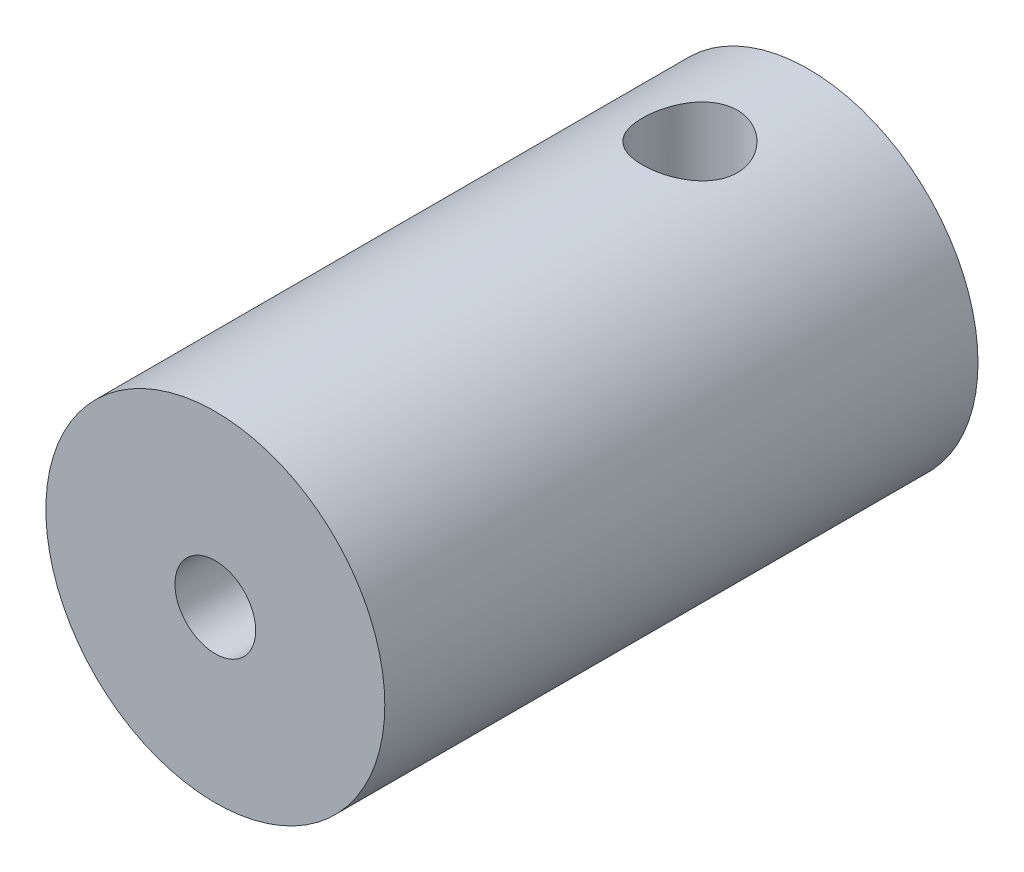
from build123d import *

# Parameters (mm, degrees)
SKETCH1_R           = 10
BOSS_EXTRUDE1_DEPTH = 35
SKETCH2_R           = 2.9
CUT_EXTRUDE1_DEPTH  = 12
CUT_EXTRUDE1_DRAFT  = 1
SKETCH4_R           = 2.38125
CUT_EXTRUDE2_DEPTH  = 35
SKETCH5_R           = 2.8
CUT_EXTRUDE3_DEPTH  = 38.749172176


with BuildPart() as part:
    # Sketch1 → Boss-Extrude1 (new body)
    with BuildSketch(Plane.XY):
        Circle(SKETCH1_R)
    extrude(amount=BOSS_EXTRUDE1_DEPTH)


with BuildPart() as cut_extrude1_tool:
    # Sketch2 → Cut-Extrude1 (with draft: the straight prism first)
    with BuildSketch(Plane.XY.offset(12)):
        Circle(SKETCH2_R)
    extrude(amount=-CUT_EXTRUDE1_DEPTH)
    # Cut-Extrude1: the draft: its side faces are tilted about the plane it starts from
    cut_extrude1_sides = [cut_extrude1_tool.faces().sort_by_distance(p)[0] for p in [
        (-2.9, 0, 6),
    ]]
    draft(cut_extrude1_sides, Plane.XY.offset(12), CUT_EXTRUDE1_DRAFT)


with BuildPart() as part_1:
    add(part.part)

    # Cut-Extrude1: cut by cut_extrude1_tool
    add(cut_extrude1_tool.part, mode=Mode.SUBTRACT)

    # Sketch4 → Cut-Extrude2 (cut)
    with BuildSketch(Plane.XY.offset(35)):
        Circle(SKETCH4_R)
    extrude(amount=-CUT_EXTRUDE2_DEPTH, mode=Mode.SUBTRACT)

    # Sketch5 → Cut-Extrude3 (cut, through all)
    with BuildSketch(Plane(origin=(0, 0, 0), x_dir=(1, 0, 0), z_dir=(0, 1, 0))):
        with Locations(Location((0, -7, 0), (0, 0, 90))):
            Circle(SKETCH5_R)
    extrude(amount=CUT_EXTRUDE3_DEPTH, mode=Mode.SUBTRACT)


solid = part_1.part
